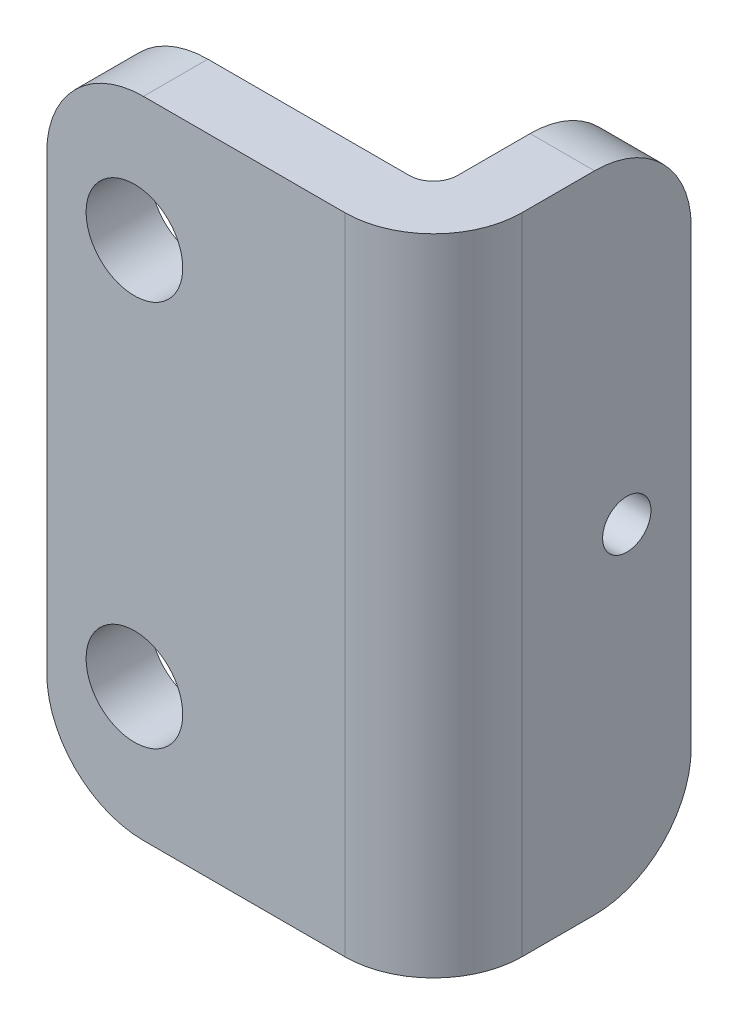
from build123d import *

# Parameters (mm, degrees)
BOSS_EXTRUDE1_DEPTH = 20
FILLET1_R           = 3
SKETCH3_R           = 1.5
CUT_EXTRUDE1_DEPTH  = 24.600847442
SKETCH4_R           = 0.75
CUT_EXTRUDE2_DEPTH  = 24.430749028
SCALE1_SCALE        = 1.9


with BuildPart() as part:
    # Sketch2 → Boss-Extrude1 (new body)
    with BuildSketch(Plane(origin=(0, 0, 0), x_dir=(1, 0, 0), z_dir=(0, 1, 0))):
        with BuildLine():
            Line((-1, 7), (1, 7))
            Line((1, 7), (1, 1.75))
            ThreePointArc((1, 1.75), (0.194543648, -0.194543648), (-1.75, -1))
            Line((-1.75, -1), (-11, -1))
            Line((-11, -1), (-11, 1))
            Line((-11, 1), (-1.75, 1))
            ThreePointArc((-1.75, 1), (-1.219669914, 1.219669914), (-1, 1.75))
            Line((-1, 1.75), (-1, 7))
        make_face()
    extrude(amount=BOSS_EXTRUDE1_DEPTH)

    # Fillet1
    fillet1_edges = [part.edges().sort_by_distance(p)[0] for p in [
        (-11, 0, 0),
        (-11, 20, 0),
        (0, 20, -7),
        (0, 0, -7),
    ]]
    fillet(fillet1_edges, radius=FILLET1_R)

    # Sketch3 → Cut-Extrude1 (cut, through all)
    with BuildSketch(Plane(origin=(0, 0, -1), x_dir=(-1, 0, 0), z_dir=(0, 0, -1))):
        with Locations((8.28, 16)):
            Circle(SKETCH3_R)
        with Locations((8.28, 4)):
            Circle(SKETCH3_R)
    extrude(amount=-CUT_EXTRUDE1_DEPTH, mode=Mode.SUBTRACT)

    # Sketch4 → Cut-Extrude2 (cut, through all)
    with BuildSketch(Plane.ZY.offset(1)):
        with Locations((-5, 10)):
            Circle(SKETCH4_R)
    extrude(amount=-CUT_EXTRUDE2_DEPTH, mode=Mode.SUBTRACT)


with BuildPart() as part_1:
    # Scale1: scaled about (-3.269699992, 10, -1.413989503)
    add(part.part.scale(SCALE1_SCALE).moved(Location((2.942729993, -9, 1.272590553))))


solid = part_1.part
